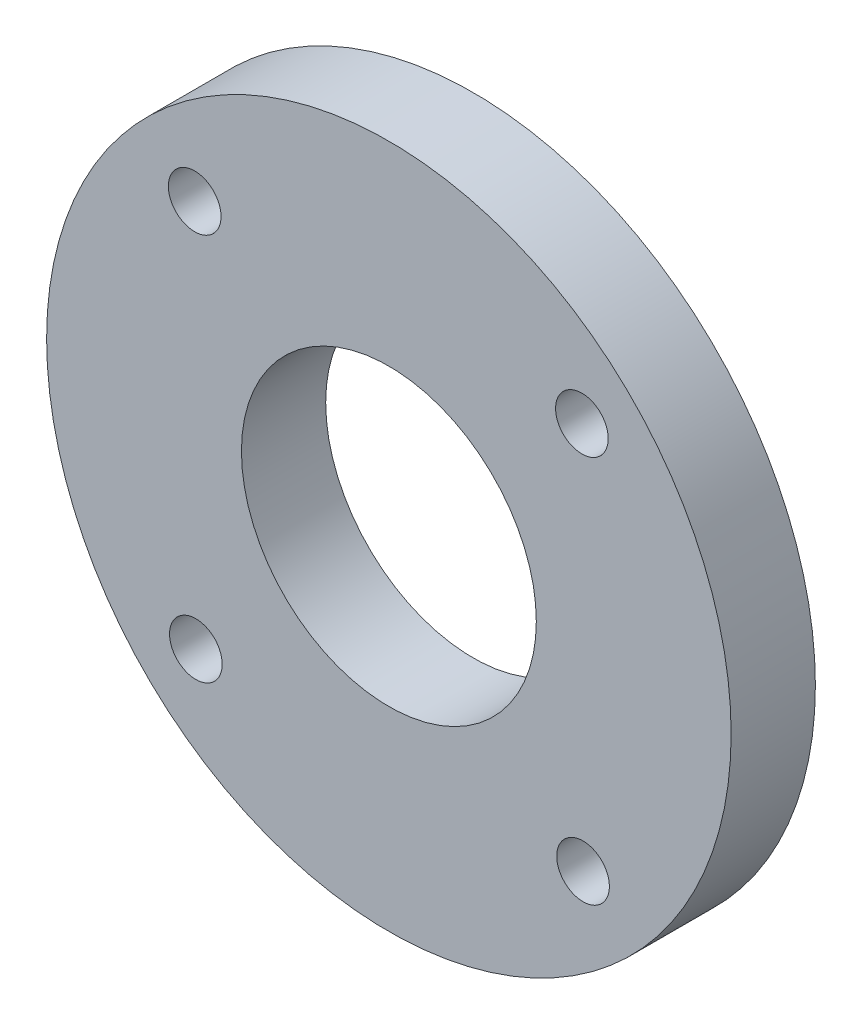
from build123d import *

# Parameters (mm, degrees)
SKETCH_2_R      = 32.5
SKETCH_2_R_2    = 2.5
SKETCH_2_R_3    = 14
EXTRUDE_2_DEPTH = 8


with BuildPart() as part:
    # Эскиз2 → Вытянуть2 (new body)
    with BuildSketch(Plane.XY):
        Circle(SKETCH_2_R)
        with Locations((-18.438809137, 18.327731563)):
            Circle(SKETCH_2_R_2, mode=Mode.SUBTRACT)
        with Locations((-18.327731563, -18.438809137)):
            Circle(SKETCH_2_R_2, mode=Mode.SUBTRACT)
        with Locations((18.327731563, 18.438809137)):
            Circle(SKETCH_2_R_2, mode=Mode.SUBTRACT)
        with Locations((18.438809137, -18.327731563)):
            Circle(SKETCH_2_R_2, mode=Mode.SUBTRACT)
        Circle(SKETCH_2_R_3, mode=Mode.SUBTRACT)
    extrude(amount=EXTRUDE_2_DEPTH)


solid = part.part
